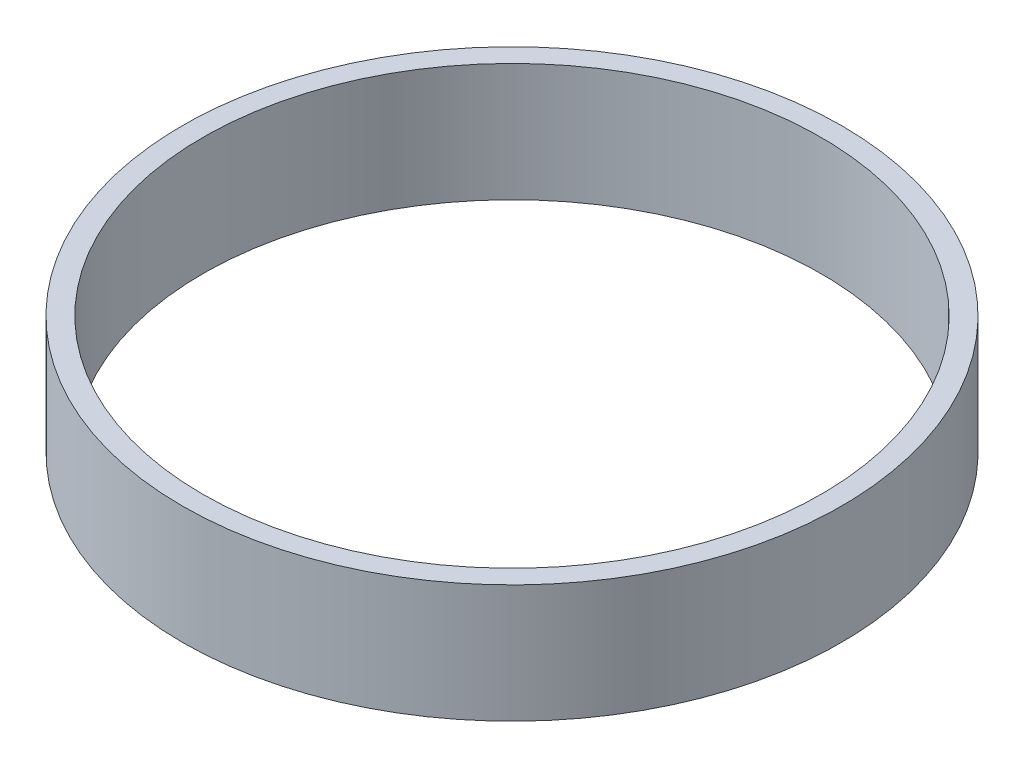
from build123d import *

# Parameters (mm, degrees)
SKETCH1_R           = 38.1
SKETCH1_R_2         = 35.74
BOSS_EXTRUDE1_DEPTH = 13.65


with BuildPart() as part:
    # Sketch1 → Boss-Extrude1 (new body)
    with BuildSketch(Plane(origin=(0, 0, 0), x_dir=(1, 0, 0), z_dir=(0, 1, 0))):
        with Locations(Location((0, 0, 0), (0, 0, 270))):
            Circle(SKETCH1_R)
        with Locations(Location((0, 0, 0), (0, 0, 270))):
            Circle(SKETCH1_R_2, mode=Mode.SUBTRACT)
    extrude(amount=BOSS_EXTRUDE1_DEPTH)


solid = part.part
